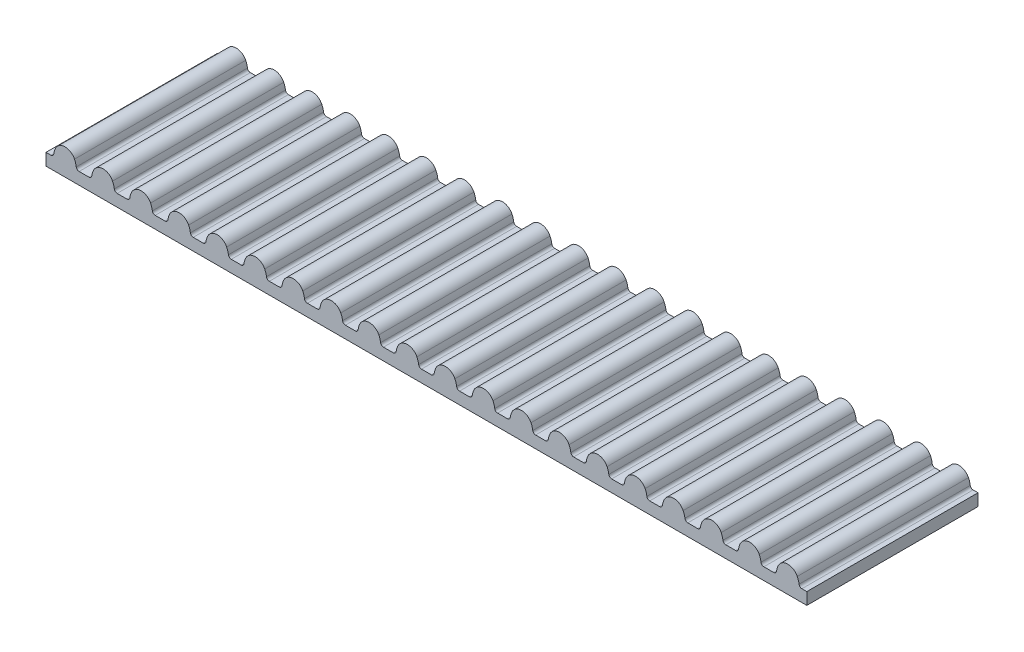
from build123d import *

# Parameters (mm, degrees)
WIDTH_EXTRUDE_DEPTH = 9
PATTERN_COUNT       = 20
PATTERN_PITCH       = 2


with BuildPart() as part:
    # Width Sketch → Width Extrude (new body)
    with BuildSketch(Plane.XY):
        with BuildLine():
            Line((0, 0), (1, 0))
            Line((1, 0), (1, 1.38))
            ThreePointArc((1, 1.38), (0.705850588, 1.295639059), (0.501123596, 1.068202247))
            ThreePointArc((0.501123596, 1.068202247), (0.442388286, 0.918062154), (0.408543109, 0.760434783))
            ThreePointArc((0.408543109, 0.760434783), (0.358731646, 0.667228588), (0.259824575, 0.63))
            Line((0.259824575, 0.63), (0, 0.63))
            Line((0, 0.63), (0, 0))
        make_face()
    extrude(amount=WIDTH_EXTRUDE_DEPTH)

    # Mirror 2: part across plane


with BuildPart() as part_1:
    add(part.part)
    add(part.part.mirror(Plane(origin=(1, 0, 9), x_dir=(0, 0, 1), z_dir=(-1, 0, 0))))


with BuildPart() as pattern_1:
    # Pattern: pattern copy
    add(part_1.part.moved(Location(Vector(1, 0, 0) * (1 * PATTERN_PITCH))))


with BuildPart() as pattern_2:
    # Pattern: pattern copy
    add(part_1.part.moved(Location(Vector(1, 0, 0) * (2 * PATTERN_PITCH))))


with BuildPart() as pattern_3:
    # Pattern: pattern copy
    add(part_1.part.moved(Location(Vector(1, 0, 0) * (3 * PATTERN_PITCH))))


with BuildPart() as pattern_4:
    # Pattern: pattern copy
    add(part_1.part.moved(Location(Vector(1, 0, 0) * (4 * PATTERN_PITCH))))


with BuildPart() as pattern_5:
    # Pattern: pattern copy
    add(part_1.part.moved(Location(Vector(1, 0, 0) * (5 * PATTERN_PITCH))))


with BuildPart() as pattern_6:
    # Pattern: pattern copy
    add(part_1.part.moved(Location(Vector(1, 0, 0) * (6 * PATTERN_PITCH))))


with BuildPart() as pattern_7:
    # Pattern: pattern copy
    add(part_1.part.moved(Location(Vector(1, 0, 0) * (7 * PATTERN_PITCH))))


with BuildPart() as pattern_8:
    # Pattern: pattern copy
    add(part_1.part.moved(Location(Vector(1, 0, 0) * (8 * PATTERN_PITCH))))


with BuildPart() as pattern_9:
    # Pattern: pattern copy
    add(part_1.part.moved(Location(Vector(1, 0, 0) * (9 * PATTERN_PITCH))))


with BuildPart() as pattern_10:
    # Pattern: pattern copy
    add(part_1.part.moved(Location(Vector(1, 0, 0) * (10 * PATTERN_PITCH))))


with BuildPart() as pattern_11:
    # Pattern: pattern copy
    add(part_1.part.moved(Location(Vector(1, 0, 0) * (11 * PATTERN_PITCH))))


with BuildPart() as pattern_12:
    # Pattern: pattern copy
    add(part_1.part.moved(Location(Vector(1, 0, 0) * (12 * PATTERN_PITCH))))


with BuildPart() as pattern_13:
    # Pattern: pattern copy
    add(part_1.part.moved(Location(Vector(1, 0, 0) * (13 * PATTERN_PITCH))))


with BuildPart() as pattern_14:
    # Pattern: pattern copy
    add(part_1.part.moved(Location(Vector(1, 0, 0) * (14 * PATTERN_PITCH))))


with BuildPart() as pattern_15:
    # Pattern: pattern copy
    add(part_1.part.moved(Location(Vector(1, 0, 0) * (15 * PATTERN_PITCH))))


with BuildPart() as pattern_16:
    # Pattern: pattern copy
    add(part_1.part.moved(Location(Vector(1, 0, 0) * (16 * PATTERN_PITCH))))


with BuildPart() as pattern_17:
    # Pattern: pattern copy
    add(part_1.part.moved(Location(Vector(1, 0, 0) * (17 * PATTERN_PITCH))))


with BuildPart() as pattern_18:
    # Pattern: pattern copy
    add(part_1.part.moved(Location(Vector(1, 0, 0) * (18 * PATTERN_PITCH))))


with BuildPart() as pattern_19:
    # Pattern: pattern copy
    add(part_1.part.moved(Location(Vector(1, 0, 0) * (19 * PATTERN_PITCH))))


with BuildPart() as part_2:
    add(part_1.part)

    # Combine: union Pattern_19, Pattern_18, Pattern_17, Pattern_16, Pattern_15, Pattern_14, Pattern_13, Pattern_12, Pattern_11, Pattern_10, Pattern_9, Pattern_8, Pattern_7, Pattern_6, Pattern_5, Pattern_4, Pattern_3, Pattern_2, Pattern_1
    add(pattern_19.part)
    add(pattern_18.part)
    add(pattern_17.part)
    add(pattern_16.part)
    add(pattern_15.part)
    add(pattern_14.part)
    add(pattern_13.part)
    add(pattern_12.part)
    add(pattern_11.part)
    add(pattern_10.part)
    add(pattern_9.part)
    add(pattern_8.part)
    add(pattern_7.part)
    add(pattern_6.part)
    add(pattern_5.part)
    add(pattern_4.part)
    add(pattern_3.part)
    add(pattern_2.part)
    add(pattern_1.part)


solid = part_2.part
